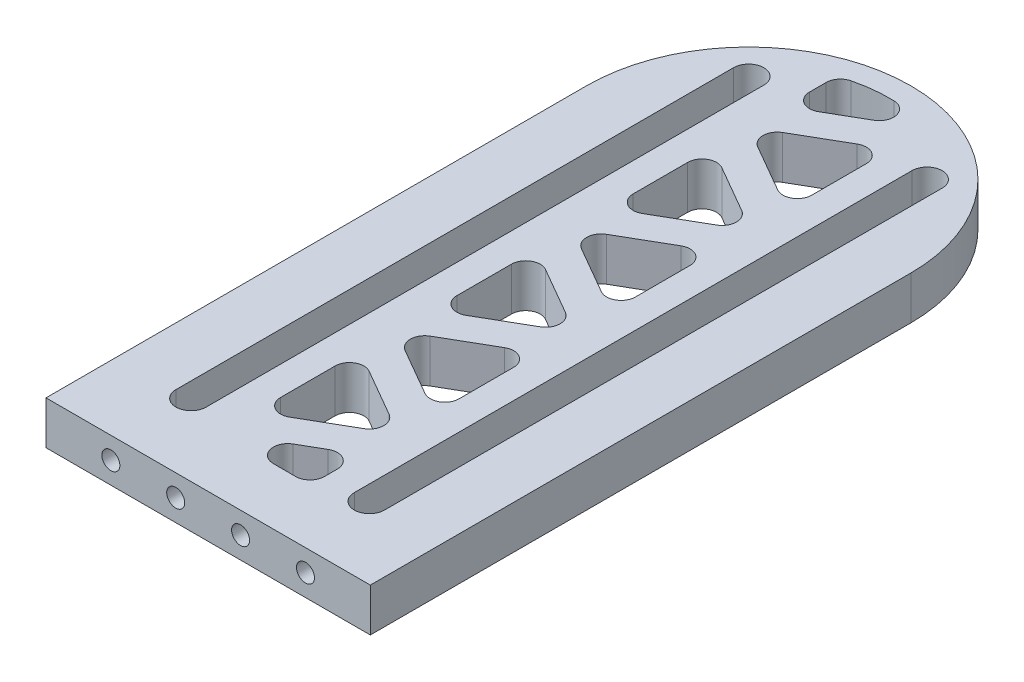
from build123d import *

# Parameters (mm, degrees)
EXTRUDE_1_DEPTH     = 6
CUT_EXTRUDE_1_DEPTH = 79.531840676
CUT_EXTRUDE_2_DEPTH = 79.531840676
FILLET_1_R          = 2
M3X0_51_D           = 2.5
M3X0_51_DEPTH       = 8.5
M3X0_51_TIP         = 0.751075774


with BuildPart() as part:
    # Эскиз1 → Бобышка-Вытянуть1 (new body)
    with BuildSketch(Plane(origin=(0, 0, 0), x_dir=(1, 0, 0), z_dir=(0, 1, 0))):
        with BuildLine():
            Line((-22.5, 0), (-22.5, -75))
            Line((-22.5, -75), (22.5, -75))
            Line((22.5, -75), (22.5, 0))
            ThreePointArc((22.5, 0), (0, 22.5), (-22.5, 0))
        make_face()
    extrude(amount=EXTRUDE_1_DEPTH)

    # Эскиз2 → Вырез-Вытянуть1 (cut, through all)
    with BuildSketch(Plane(origin=(0, 6, 0), x_dir=(1, 0, 0), z_dir=(0, 1, 0))):
        with BuildLine():
            Line((-10.274368671, 12.374368671), (-10.274368671, -65))
            ThreePointArc((-10.274368671, -65), (-12.374368671, -67.1), (-14.474368671, -65))
            Line((-14.474368671, -65), (-14.474368671, 12.374368671))
            ThreePointArc((-14.474368671, 12.374368671), (-12.374368671, 14.474368671), (-10.274368671, 12.374368671))
        make_face()
        with BuildLine():
            Line((10.274368671, 12.374368671), (10.274368671, -65))
            ThreePointArc((10.274368671, -65), (12.374368671, -67.1), (14.474368671, -65))
            Line((14.474368671, -65), (14.474368671, 12.374368671))
            ThreePointArc((14.474368671, 12.374368671), (12.374368671, 14.474368671), (10.274368671, 12.374368671))
        make_face()
    extrude(amount=-CUT_EXTRUDE_1_DEPTH, mode=Mode.SUBTRACT)

    # Эскиз11 → Вырез-Вытянуть2 (cut, through all)
    with BuildSketch(Plane(origin=(0, 6, 0), x_dir=(1, 0, 0), z_dir=(0, 1, 0))):
        with BuildLine():
            Line((6.274368671, 18.5), (-6.274368671, 11.254983118))
            Line((-6.274368671, 11.254983118), (-6.274368671, 18.5))
            ThreePointArc((-6.274368671, 18.5), (0, 19.535037809), (6.274368671, 18.5))
        make_face()
        Polygon((-6.274368671, 6.266676792), (6.274368671, 13.511693674), (6.274368671, -0.97834009), align=None)
        Polygon((-6.274368671, 1.278370466), (6.274368671, -5.966646416), (-6.274368671, -13.211663298), align=None)
        Polygon((-6.274368671, -18.199969624), (6.274368671, -10.954952742), (6.274368671, -25.444986506), align=None)
        Polygon((-6.274368671, -23.18827595), (6.274368671, -30.433292832), (-6.274368671, -37.678309714), align=None)
        Polygon((-6.274368671, -42.66661604), (6.274368671, -35.421599157), (6.274368671, -49.911632922), align=None)
        Polygon((-6.274368671, -47.654922365), (6.274368671, -54.899939248), (-6.274368671, -62.14495613), align=None)
        Polygon((-6.274368671, -67.133262455), (6.274368671, -67.133262455), (6.274368671, -59.888245573), align=None)
    extrude(amount=-CUT_EXTRUDE_2_DEPTH, mode=Mode.SUBTRACT)

    # Скругление1
    fillet_1_edges = [part.edges().sort_by_distance(p)[0] for p in [
        (-6.274368671, 3, 62.14495613),
        (-6.274368671, 3, 47.654922365),
        (6.274368671, 3, 54.899939248),
        (-6.274368671, 3, 67.133262455),
        (6.274368671, 3, 59.888245573),
        (6.274368671, 3, 67.133262455),
        (-6.274368671, 3, -18.5),
        (6.274368671, 3, -18.5),
        (-6.274368671, 3, -11.254983118),
        (6.274368671, 3, 0.97834009),
        (-6.274368671, 3, -6.266676792),
        (6.274368671, 3, -13.511693674),
        (-6.274368671, 3, 13.211663298),
        (-6.274368671, 3, -1.278370466),
        (6.274368671, 3, 5.966646416),
        (6.274368671, 3, 25.444986506),
        (-6.274368671, 3, 18.199969624),
        (6.274368671, 3, 10.954952742),
        (-6.274368671, 3, 37.678309714),
        (-6.274368671, 3, 23.18827595),
        (6.274368671, 3, 30.433292832),
        (6.274368671, 3, 49.911632922),
        (-6.274368671, 3, 42.66661604),
        (6.274368671, 3, 35.421599157),
    ]]
    fillet(fillet_1_edges, radius=FILLET_1_R)

    # Отверстие обработанное метчиком M3x0.51
    with Locations(Plane.XY.offset(75)):
        with Locations((-13.5, 3), (-4.5, 3), (4.5, 3), (13.5, 3)):
            Hole(M3X0_51_D / 2, depth=M3X0_51_DEPTH)
            with Locations((0, 0, -(M3X0_51_DEPTH + M3X0_51_TIP / 2))):  # 118° drill point
                Cone(0, M3X0_51_D / 2, M3X0_51_TIP, mode=Mode.SUBTRACT)


solid = part.part
